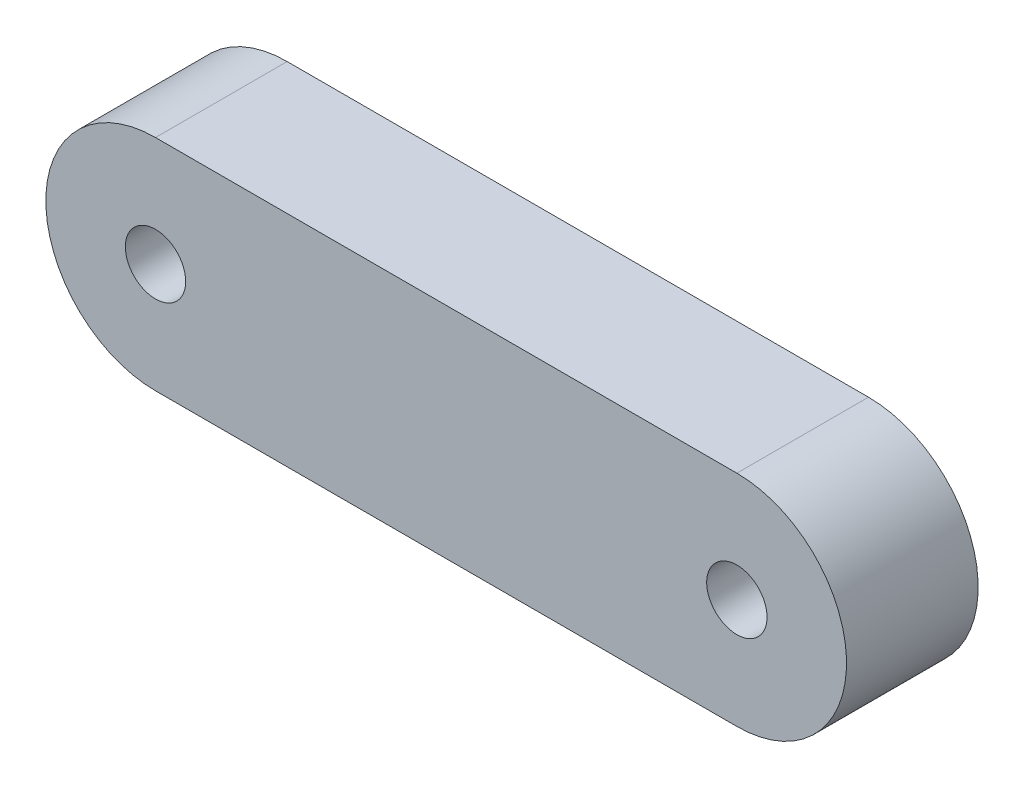
from build123d import *

# Parameters (mm, degrees)
SKETCH1_R           = 2.75
BOSS_EXTRUDE1_DEPTH = 12


with BuildPart() as part:
    # Sketch1 → Boss-Extrude1 (new body)
    with BuildSketch(Plane.XY):
        with BuildLine():
            Line((0, -10), (-53, -10))
            ThreePointArc((-53, -10), (-63, 0), (-53, 10))
            Line((-53, 10), (0, 10))
            ThreePointArc((0, 10), (10, 0), (0, -10))
        make_face()
        with Locations((-53, 0)):
            Circle(SKETCH1_R, mode=Mode.SUBTRACT)
        Circle(SKETCH1_R, mode=Mode.SUBTRACT)
    extrude(amount=BOSS_EXTRUDE1_DEPTH)


solid = part.part
